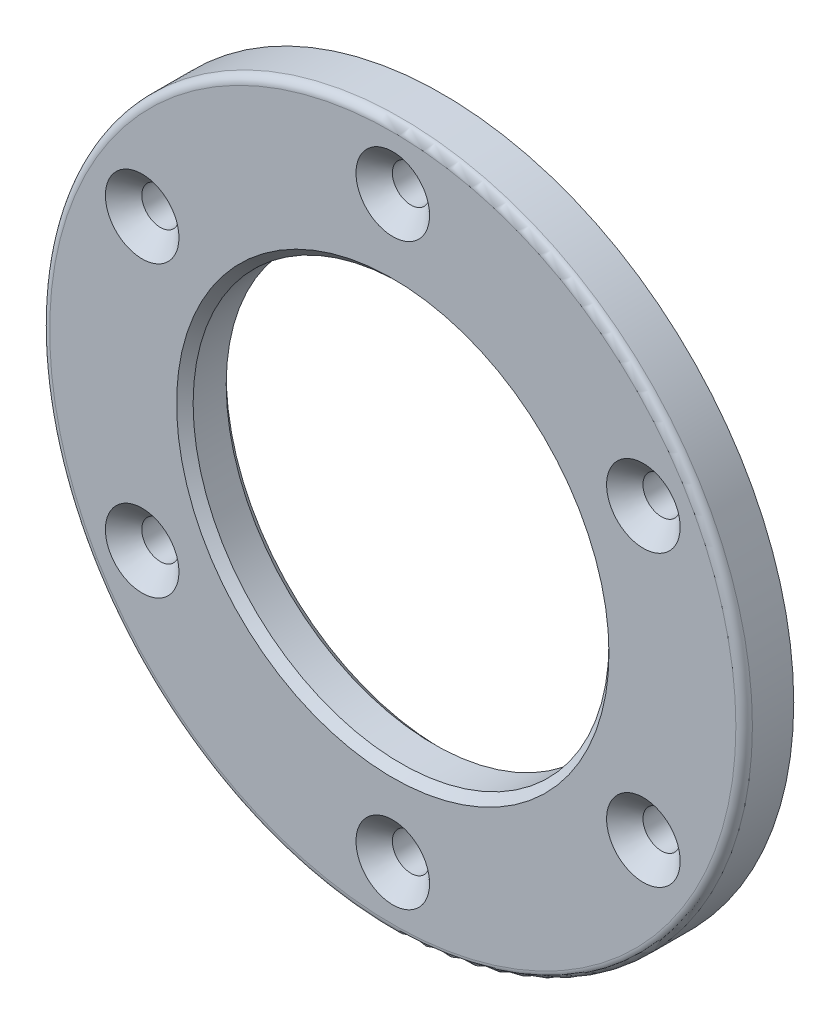
from build123d import *

# Parameters (mm, degrees)
SKETCH1_R                    = 42.5
BOSS_EXTRUDE1_DEPTH          = 6
SKETCH2_R                    = 25.15
CUT_EXTRUDE1_DEPTH           = 61.402814504
SKETCH3_R                    = 2.25
CUT_EXTRUDE2_DEPTH           = 61.402814504
CHAMFER2_SIZE                = 2.2
CIRPATTERN1_COUNT            = 6
CHAMFER2_OF_CIRPATTERN1_SIZE = 2.2
CHAMFER1_SIZE                = 1
FILLET1_R                    = 1


with BuildPart() as part:
    # Sketch1 → Boss-Extrude1 (new body)
    with BuildSketch(Plane.XY):
        Circle(SKETCH1_R)
    extrude(amount=BOSS_EXTRUDE1_DEPTH)

    # Sketch2 → Cut-Extrude1 (cut, through all)
    with BuildSketch(Plane.XY.offset(6)):
        Circle(SKETCH2_R)
    extrude(amount=-CUT_EXTRUDE1_DEPTH, mode=Mode.SUBTRACT)

    # Sketch3 → Cut-Extrude2 (cut, through all)
    with BuildSketch(Plane.XY.offset(6)):
        with Locations((0, 35)):
            Circle(SKETCH3_R)
    cut_extrude2 = extrude(amount=-CUT_EXTRUDE2_DEPTH, mode=Mode.SUBTRACT)

    # Chamfer2
    chamfer2_edges = [part.edges().sort_by_distance(p)[0] for p in [
        (-2.25, 35, 6),
    ]]
    chamfer(chamfer2_edges, length=CHAMFER2_SIZE)

    # CirPattern1: Cut-Extrude2 ×6 about axis
    cirpattern1_axis = Axis((0, 0, 0), (0, 0, 1))
    for i in range(1, CIRPATTERN1_COUNT):
        add(cut_extrude2.rotate(cirpattern1_axis, i * 360 / CIRPATTERN1_COUNT), mode=Mode.SUBTRACT)

    # Chamfer2 of CirPattern1
    chamfer2_of_cirpattern1_edges = [part.edges().sort_by_distance(p)[0] for p in [
        (-31.435889132, 15.551442841, 6),
        (-29.185889132, -19.448557159, 6),
        (2.25, -35, 6),
        (31.435889132, -15.551442841, 6),
        (29.185889132, 19.448557159, 6),
    ]]
    chamfer(chamfer2_of_cirpattern1_edges, length=CHAMFER2_OF_CIRPATTERN1_SIZE)

    # Chamfer1
    chamfer1_edges = [part.edges().sort_by_distance(p)[0] for p in [
        (-25.15, 0, 0),
        (-25.15, 0, 6),
    ]]
    chamfer(chamfer1_edges, length=CHAMFER1_SIZE)

    # Fillet1
    fillet1_edges = [part.edges().sort_by_distance(p)[0] for p in [
        (-42.5, 0, 6),
    ]]
    fillet(fillet1_edges, radius=FILLET1_R)


solid = part.part
